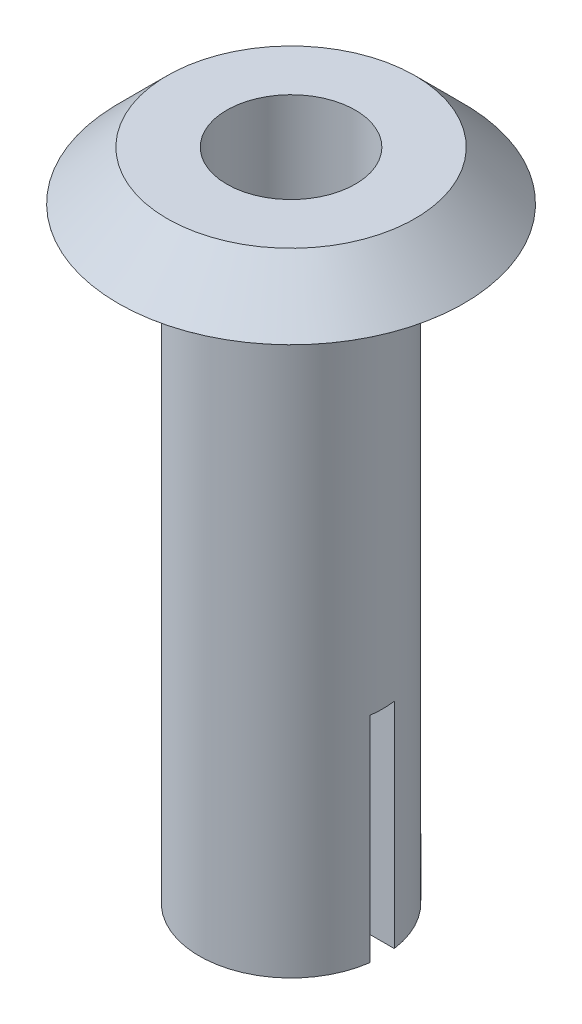
from build123d import *

# Parameters (mm, degrees)
CROQUIS1_R                   = 1.5
SALIENTE_EXTRUIR1_DEPTH      = 10.7
SALIENTE_EXTRUIR2_DEPTH      = 0.0001
SALIENTE_EXTRUIR2_DEPTH_BACK = 0.8
CROQUIS2_R                   = 2.825
CHAFL_N1_SIZE                = 0.8
CROQUIS3_R                   = 1.05
CORTAR_EXTRUIR1_DEPTH        = 10.4
REDONDEO2_R                  = 0.8
CROQUIS6_W                   = 3
CROQUIS6_H                   = 0.4
CORTAR_EXTRUIR4_DEPTH        = 3.5


with BuildPart() as part:
    # Croquis1 → Saliente-Extruir1 (new body)
    with BuildSketch(Plane(origin=(0, 0, 0), x_dir=(1, 0, 0), z_dir=(0, 1, 0))):
        with Locations(Location((0, 0, 0), (0, 0, 270))):
            Circle(CROQUIS1_R)
    extrude(amount=SALIENTE_EXTRUIR1_DEPTH)

    # Croquis2 → Saliente-Extruir2 (add, two sides: drawn at the far end of the back side and taken through both)
    with BuildSketch(Plane(origin=(0, 10.7, 0), x_dir=(1, 0, 0), z_dir=(0, 1, 0)).offset(-SALIENTE_EXTRUIR2_DEPTH_BACK)):
        with Locations(Location((0, 0, 0), (0, 0, 270))):
            Circle(CROQUIS2_R)
    extrude(amount=SALIENTE_EXTRUIR2_DEPTH + SALIENTE_EXTRUIR2_DEPTH_BACK)

    # Chaflán1
    chafl_n1_edges = [part.edges().sort_by_distance(p)[0] for p in [
        (0, 10.7001, -2.825),
    ]]
    chamfer(chafl_n1_edges, length=CHAFL_N1_SIZE)

    # Croquis3 → Cortar-Extruir1 (cut)
    with BuildSketch(Plane(origin=(0, 10.7001, 0), x_dir=(1, 0, 0), z_dir=(0, 1, 0))):
        with Locations(Location((0, 0, 0), (0, 0, 270))):
            Circle(CROQUIS3_R)
    extrude(amount=-CORTAR_EXTRUIR1_DEPTH, mode=Mode.SUBTRACT)

    # Redondeo2
    redondeo2_edges = [part.edges().sort_by_distance(p)[0] for p in [
        (0, 0.3001, -1.05),
    ]]
    fillet(redondeo2_edges, radius=REDONDEO2_R)

    # Croquis6 → Cortar-Extruir4 (cut)
    with BuildSketch(Plane(origin=(0, 0, 0), x_dir=(-1, 0, 0), z_dir=(0, -1, 0))):
        Rectangle(CROQUIS6_W, CROQUIS6_H)
    extrude(amount=-CORTAR_EXTRUIR4_DEPTH, mode=Mode.SUBTRACT)


solid = part.part
